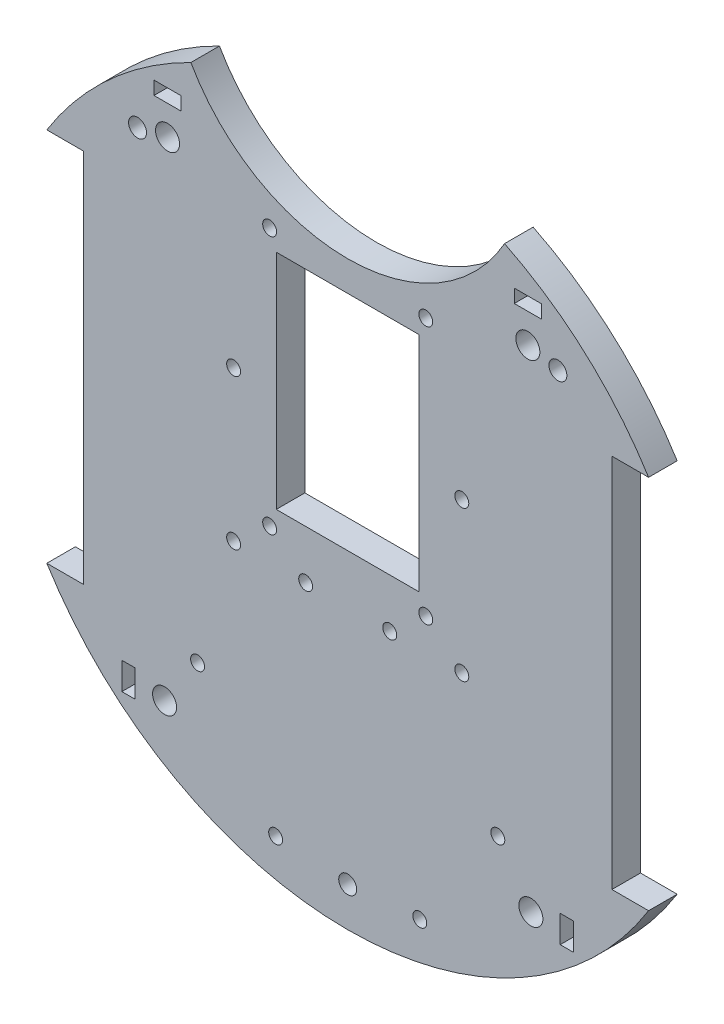
from build123d import *

# Parameters (mm, degrees)
SKETCH1_R           = 1.89865
SKETCH1_R_2         = 1.4732
BOSS_EXTRUDE3_DEPTH = 6.0452
SKETCH7_R           = 1.4732
CUT_EXTRUDE2_DEPTH  = 99.546673139
SKETCH9_R           = 1.4732
SKETCH9_W           = 30.226
SKETCH9_H           = 47.117
CUT_EXTRUDE3_DEPTH  = 14.732
SKETCH10_R          = 2.54
SKETCH10_W          = 5.7404
SKETCH10_H          = 2.8194
SKETCH10_W_2        = 2.8194
SKETCH10_H_2        = 5.7404
CUT_EXTRUDE4_DEPTH  = 6.0452


with BuildPart() as part:
    # Sketch1 → Boss-Extrude3 (new body)
    with BuildSketch(Plane.XY):
        with BuildLine():
            Line((-63.638843042, 39.6875), (-55.88, 39.6875))
            Line((-55.88, 39.6875), (-55.88, -39.6875))
            Line((-55.88, -39.6875), (-63.638843042, -39.6875))
            ThreePointArc((-63.638843042, -39.6875), (0, -75), (63.638843042, -39.6875))
            Line((63.638843042, -39.6875), (55.88, -39.6875))
            Line((55.88, -39.6875), (55.88, 39.6875))
            Line((55.88, 39.6875), (63.638843042, 39.6875))
            ThreePointArc((63.638843042, 39.6875), (50.33136084, 55.603544096), (33.172661219, 67.264957799))
            ThreePointArc((33.172661219, 67.264957799), (0, 47.904876359), (-33.172661219, 67.264957799))
            ThreePointArc((-33.172661219, 67.264957799), (-50.33136084, 55.603544096), (-63.638843042, 39.6875))
        make_face()
        with Locations((0, -66.675)):
            Circle(SKETCH1_R, mode=Mode.SUBTRACT)
        with Locations((-44.45, 49.6966108)):
            Circle(SKETCH1_R, mode=Mode.SUBTRACT)
        with Locations(Location((44.45, 49.6966108, 0), (0, 0, 180))):
            Circle(SKETCH1_R, mode=Mode.SUBTRACT)
        with Locations((-24.13, -15.875)):
            Circle(SKETCH1_R_2, mode=Mode.SUBTRACT)
        with Locations((-8.89, -15.875)):
            Circle(SKETCH1_R_2, mode=Mode.SUBTRACT)
        with Locations(Location((8.89, -15.875, 0), (0, 0, 180))):
            Circle(SKETCH1_R_2, mode=Mode.SUBTRACT)
        with Locations((-15.24, -65.475)):
            Circle(SKETCH1_R_2, mode=Mode.SUBTRACT)
        with Locations(Location((15.24, -65.475, 0), (0, 0, 180))):
            Circle(SKETCH1_R_2, mode=Mode.SUBTRACT)
        with Locations(Location((24.13, -15.875, 0), (0, 0, 180))):
            Circle(SKETCH1_R_2, mode=Mode.SUBTRACT)
        with Locations((8.89, 15.875)):
            Circle(SKETCH1_R_2, mode=Mode.SUBTRACT)
        with Locations(Location((-8.89, 15.875, 0), (0, 0, 180))):
            Circle(SKETCH1_R_2, mode=Mode.SUBTRACT)
        with Locations((24.13, 15.875)):
            Circle(SKETCH1_R_2, mode=Mode.SUBTRACT)
        with Locations(Location((-24.13, 15.875, 0), (0, 0, 180))):
            Circle(SKETCH1_R_2, mode=Mode.SUBTRACT)
    extrude(amount=BOSS_EXTRUDE3_DEPTH)

    # Sketch7 → Cut-Extrude2 (cut, through all)
    with BuildSketch(Plane.XY.offset(6.0452)):
        with Locations(Location((-31.75, -41.98, 0), (0, 0, 180))):
            Circle(SKETCH7_R)
        with Locations((31.75, -41.98)):
            Circle(SKETCH7_R)
    extrude(amount=-CUT_EXTRUDE2_DEPTH, mode=Mode.SUBTRACT)

    # Sketch9 → Cut-Extrude3 (cut)
    with BuildSketch(Plane.XY.offset(6.0452)):
        with Locations((-16.51, 45.301376359)):
            Circle(SKETCH9_R)
        with Locations((16.51, 45.301376359)):
            Circle(SKETCH9_R)
        with Locations((-16.51, -9.308623641)):
            Circle(SKETCH9_R)
        with Locations((16.51, -9.308623641)):
            Circle(SKETCH9_R)
        with Locations((0, 17.996376359)):
            Rectangle(SKETCH9_W, SKETCH9_H)
    extrude(amount=-CUT_EXTRUDE3_DEPTH, mode=Mode.SUBTRACT)

    # Sketch10 → Cut-Extrude4 (cut)
    with BuildSketch(Plane.XY.offset(6.0452)):
        with Locations((-38.735, -52.3875)):
            Circle(SKETCH10_R)
        with Locations((38.735, -52.3875)):
            Circle(SKETCH10_R)
        with Locations((-38.1, 51.1175)):
            Circle(SKETCH10_R)
        with Locations((38.1, 51.1175)):
            Circle(SKETCH10_R)
        with Locations((-38.1, 58.7375)):
            Rectangle(SKETCH10_W, SKETCH10_H)
        with Locations((38.1, 58.7375)):
            Rectangle(SKETCH10_W, SKETCH10_H)
        with Locations((-46.355, -52.3875)):
            Rectangle(SKETCH10_W_2, SKETCH10_H_2)
        with Locations((46.355, -52.3875)):
            Rectangle(SKETCH10_W_2, SKETCH10_H_2)
    extrude(amount=-CUT_EXTRUDE4_DEPTH, mode=Mode.SUBTRACT)


solid = part.part
